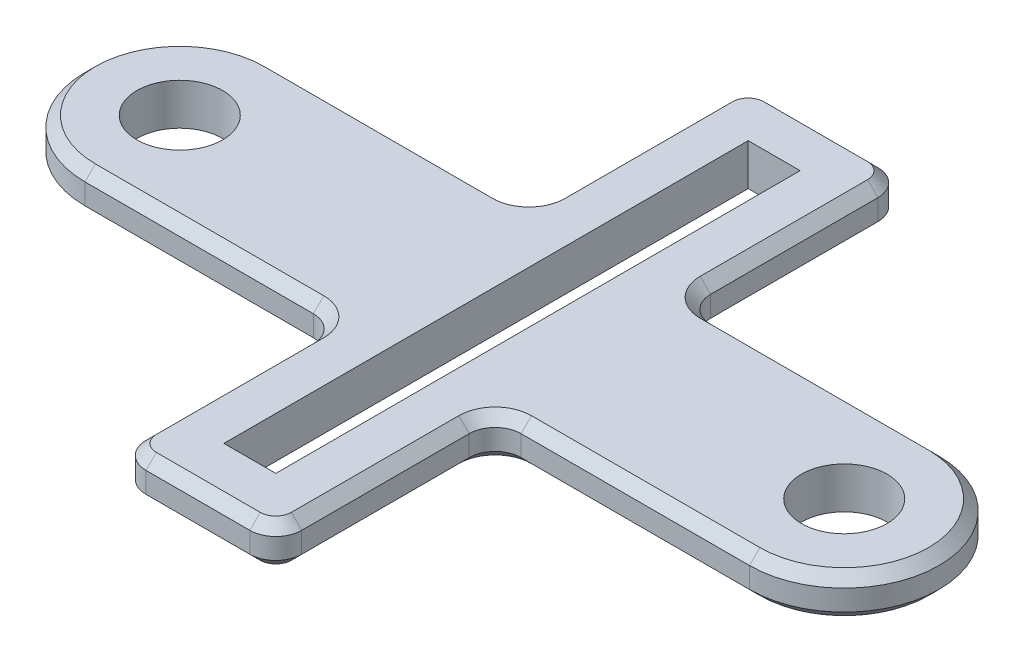
from build123d import *

# Parameters (mm, degrees)
SKETCH1_R           = 4.125
SKETCH1_W           = 5
SKETCH1_H           = 50.5
BOSS_EXTRUDE1_DEPTH = 4
FILLET1_R           = 2.5
CHAMFER1_SIZE       = 1


with BuildPart() as part:
    # Sketch1 → Boss-Extrude1 (new body)
    with BuildSketch(Plane(origin=(0, 0, 0), x_dir=(1, 0, 0), z_dir=(0, 1, 0))):
        with BuildLine():
            Line((-32, 9.125), (-7.5, 9.125))
            Line((-7.5, 9.125), (-7.5, 30.25))
            Line((-7.5, 30.25), (7.5, 30.25))
            Line((7.5, 30.25), (7.5, 9.125))
            Line((7.5, 9.125), (32, 9.125))
            ThreePointArc((32, 9.125), (41.125, 0), (32, -9.125))
            Line((32, -9.125), (7.5, -9.125))
            Line((7.5, -9.125), (7.5, -30.25))
            Line((7.5, -30.25), (-7.5, -30.25))
            Line((-7.5, -30.25), (-7.5, -9.125))
            Line((-7.5, -9.125), (-32, -9.125))
            ThreePointArc((-32, -9.125), (-41.125, 0), (-32, 9.125))
        make_face()
        with Locations(Location((-32, 0, 0), (0, 0, 270))):
            Circle(SKETCH1_R, mode=Mode.SUBTRACT)
        with Locations(Location((32, 0, 0), (0, 0, 90))):
            Circle(SKETCH1_R, mode=Mode.SUBTRACT)
        Rectangle(SKETCH1_W, SKETCH1_H, mode=Mode.SUBTRACT)
    extrude(amount=BOSS_EXTRUDE1_DEPTH)

    # Fillet1
    fillet1_edges = [part.edges().sort_by_distance(p)[0] for p in [
        (-7.5, 2, -9.125),
        (-7.5, 2, -30.25),
        (7.5, 2, -30.25),
        (7.5, 2, -9.125),
        (7.5, 2, 9.125),
        (7.5, 2, 30.25),
        (-7.5, 2, 30.25),
        (-7.5, 2, 9.125),
    ]]
    fillet(fillet1_edges, radius=FILLET1_R)

    # Chamfer1
    chamfer1_edges = [part.edges().sort_by_distance(p)[0] for p in [
        (21, 0, -9.125),
        (41.125, 0, 0),
        (-21, 0, 9.125),
        (-41.125, 0, 0),
        (41.125, 4, 0),
        (21, 4, -9.125),
        (-41.125, 4, 0),
        (-7.5, 0, 19.6875),
        (-7.5, 4, 19.6875),
        (0, 0, 30.25),
        (0, 4, 30.25),
        (-21, 0, -9.125),
        (-7.5, 0, -19.6875),
        (0, 0, -30.25),
        (7.5, 0, -19.6875),
        (21, 0, 9.125),
        (7.5, 0, 19.6875),
        (-6.767766953, 0, -29.517766953),
        (6.767766953, 0, -29.517766953),
        (6.767766953, 0, 29.517766953),
        (-6.767766953, 0, 29.517766953),
        (7.5, 4, 19.6875),
        (21, 4, 9.125),
        (7.5, 4, -19.6875),
        (0, 4, -30.25),
        (-7.5, 4, -19.6875),
        (-21, 4, -9.125),
        (-6.767766953, 4, -29.517766953),
        (6.767766953, 4, -29.517766953),
        (6.767766953, 4, 29.517766953),
        (-6.767766953, 4, 29.517766953),
        (-8.232233047, 0, 9.857233047),
        (-8.232233047, 4, 9.857233047),
        (8.232233047, 0, 9.857233047),
        (8.232233047, 4, 9.857233047),
        (8.232233047, 0, -9.857233047),
        (8.232233047, 4, -9.857233047),
        (-8.232233047, 0, -9.857233047),
        (-8.232233047, 4, -9.857233047),
        (-21, 4, 9.125),
    ]]
    chamfer(chamfer1_edges, length=CHAMFER1_SIZE)


solid = part.part
